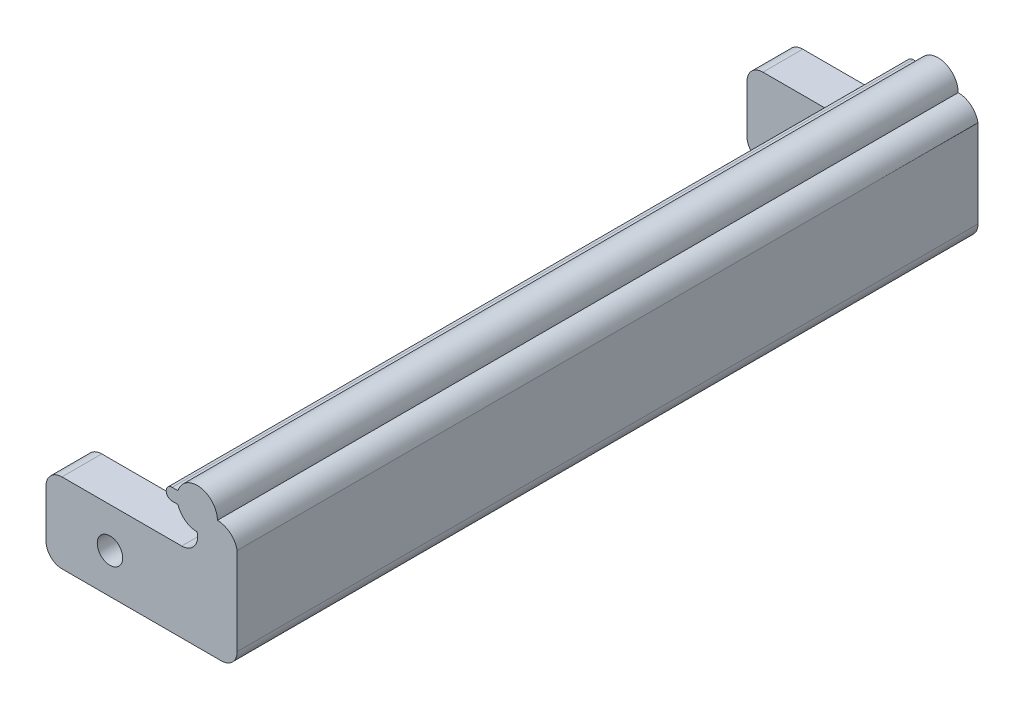
from build123d import *

# Parameters (mm, degrees)
SKETCH1_R           = 1.6
BOSS_EXTRUDE1_DEPTH = 93
SKETCH3_W           = 21.267787972
SKETCH3_H           = 83
CUT_EXTRUDE2_DEPTH  = 90
BOSS_EXTRUDE4_REACH = 99.216


with BuildPart() as part:
    # Sketch1 → Boss-Extrude1 (new body)
    with BuildSketch(Plane.XY):
        with BuildLine():
            Line((17.033489737, 10), (2, 10))
            ThreePointArc((2, 10), (0.585786438, 9.414213562), (0, 8))
            Line((0, 8), (0, 2))
            ThreePointArc((0, 2), (0.585786438, 0.585786438), (2, 0))
            Line((2, 0), (20.255670014, 0))
            Line((20.255670014, 0), (22, 0))
            ThreePointArc((22, 0), (23.414213562, 0.585786438), (24, 2))
            Line((24, 2), (24, 10))
            Line((24, 10), (24, 13))
            ThreePointArc((24, 13), (21.016744869, 14.983255131), (19.033489737, 12))
            ThreePointArc((19.033489737, 12), (18.447703299, 10.585786438), (17.033489737, 10))
        make_face()
        with Locations(Location((8.031280577, 5, 0), (0, 0, 180))):
            Circle(SKETCH1_R, mode=Mode.SUBTRACT)
    extrude(amount=BOSS_EXTRUDE1_DEPTH)

    # Sketch3 → Cut-Extrude2 (cut)
    with BuildSketch(Plane(origin=(0, 15, 0), x_dir=(1, 0, 0), z_dir=(0, 1, 0))):
        with Locations((10.633893986, -46.5)):
            Rectangle(SKETCH3_W, SKETCH3_H)
    extrude(amount=-CUT_EXTRUDE2_DEPTH, mode=Mode.SUBTRACT)

    # Boss-Extrude4: up to this face of the body (flat: up to its plane)
    boss_extrude4_end = Plane(part.part.faces().sort_by_distance((13.034633822, 5.682959989, 0))[0])
    # Sketch4 → Boss-Extrude4 (add, up to the picked face)
    with BuildSketch(Plane.XY.offset(93), mode=Mode.PRIVATE) as boss_extrude4_sk1:
        with BuildLine():
            ThreePointArc((21.516744869, 15.033092191), (19.36575731, 17.537199237), (16.565837736, 15.78855692))
            Line((16.565837736, 15.78855692), (15.846137498, 15.78855692))
            ThreePointArc((15.846137498, 15.78855692), (15.090672769, 15.033092191), (15.846137498, 14.277627462))
            Line((15.846137498, 14.277627462), (16.565837736, 14.277627462))
            ThreePointArc((16.565837736, 14.277627462), (17.483170381, 12.992232341), (18.983652678, 12.5))
            ThreePointArc((18.983652678, 12.5), (19.725578203, 14.291166666), (21.516744869, 15.033092191))
        make_face()
    boss_extrude4_tool1 = split(extrude(boss_extrude4_sk1.sketch, amount=-BOSS_EXTRUDE4_REACH, mode=Mode.PRIVATE), bisect_by=boss_extrude4_end, keep=Keep.BOTH, mode=Mode.PRIVATE)
    add(boss_extrude4_tool1.solids().sort_by(Axis((18.413371, 15.285709, 93), (0, 0, -1)))[0])


solid = part.part
